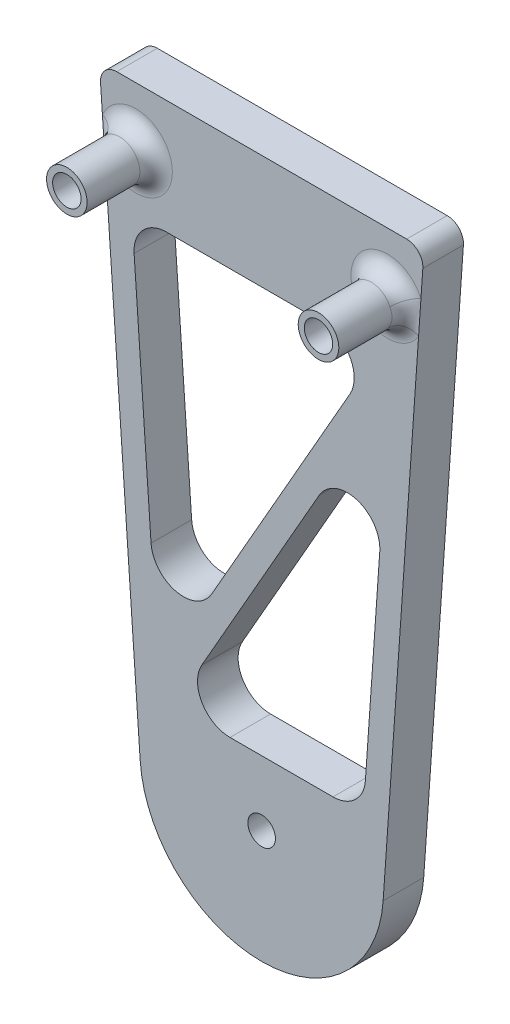
from build123d import *

# Parameters (mm, degrees)
CROQUIS1_R              = 1.7
CROQUIS1_R_2            = 1.75
SALIENTE_EXTRUIR1_DEPTH = 2.5
CROQUIS1_3_R            = 2.5
CROQUIS1_3_R_2          = 1.75
SALIENTE_EXTRUIR2_DEPTH = 11
REDONDEO1_R             = 2
REDONDEO2_R             = 2
CROQUIS2_R              = 3
CORTAR_EXTRUIR1_DEPTH   = 2
REDONDEO3_R             = 4


with BuildPart() as part:
    # Croquis1 → Saliente-Extruir1 (new, symmetric)
    with BuildSketch(Plane.XY):
        with BuildLine():
            Line((20.001432119, 0), (-20.001432119, 0))
            Line((-20.001432119, 0), (-14.963460754, -72.046347106))
            ThreePointArc((-14.963460754, -72.046347106), (0, -86), (14.963460754, -72.046347106))
            Line((14.963460754, -72.046347106), (20.001432119, 0))
        make_face()
        with Locations((0, -72.046347106)):
            Circle(CROQUIS1_R, mode=Mode.SUBTRACT)
        Polygon((-12.704099543, -61.349956664), (-16.011890152, -14.046347106), (14.28491785, -14.046347106), align=None, mode=Mode.SUBTRACT)
        Polygon((12.515549555, -64.046347106), (-10.788577252, -64.046347106), (15.770666891, -17.496000466), align=None, mode=Mode.SUBTRACT)
        with Locations((-15.5, -7.276347106)):
            Circle(CROQUIS1_R_2, mode=Mode.SUBTRACT)
        with Locations((15.5, -7.276347106)):
            Circle(CROQUIS1_R_2, mode=Mode.SUBTRACT)
    extrude(amount=SALIENTE_EXTRUIR1_DEPTH, both=True)

    # Croquis1<3> → Saliente-Extruir2 (add)
    # profile 1 of 2: a face of its own
    with BuildSketch(Plane.XY):
        with Locations((-15.5, -7.276347106)):
            Circle(CROQUIS1_3_R)
        with Locations((-15.5, -7.276347106)):
            Circle(CROQUIS1_3_R_2, mode=Mode.SUBTRACT)
    # profile 2 of 2: a face of its own
    with BuildSketch(Plane.XY):
        with Locations((15.5, -7.276347106)):
            Circle(CROQUIS1_3_R)
        with Locations((15.5, -7.276347106)):
            Circle(CROQUIS1_3_R_2, mode=Mode.SUBTRACT)
    extrude(amount=SALIENTE_EXTRUIR2_DEPTH)

    # Redondeo1
    redondeo1_edges = [part.edges().sort_by_distance(p)[0] for p in [
        (13, -7.276347106, 2.5),
        (-18, -7.276347106, 2.5),
    ]]
    fillet(redondeo1_edges, radius=REDONDEO1_R)

    # Redondeo2
    redondeo2_edges = [part.edges().sort_by_distance(p)[0] for p in [
        (20.001432119, 0, 0),
        (-20.001432119, 0, 0),
    ]]
    fillet(redondeo2_edges, radius=REDONDEO2_R)

    # Croquis2 → Cortar-Extruir1 (cut)
    with BuildSketch(Plane(origin=(0, 0, -2.5), x_dir=(-1, 0, 0), z_dir=(0, 0, -1))):
        with Locations((-15.5, -7.276347106)):
            Circle(CROQUIS2_R)
        with Locations((15.5, -7.276347106)):
            Circle(CROQUIS2_R)
    extrude(amount=-CORTAR_EXTRUIR1_DEPTH, mode=Mode.SUBTRACT)

    # Redondeo3
    redondeo3_edges = [part.edges().sort_by_distance(p)[0] for p in [
        (-16.011890152, -14.046347106, 0),
        (12.515549555, -64.046347106, 0),
        (-10.788577252, -64.046347106, 0),
        (-12.704099543, -61.349956664, 0),
        (14.28491785, -14.046347106, 0),
        (15.770666891, -17.496000466, 0),
    ]]
    fillet(redondeo3_edges, radius=REDONDEO3_R)


solid = part.part
